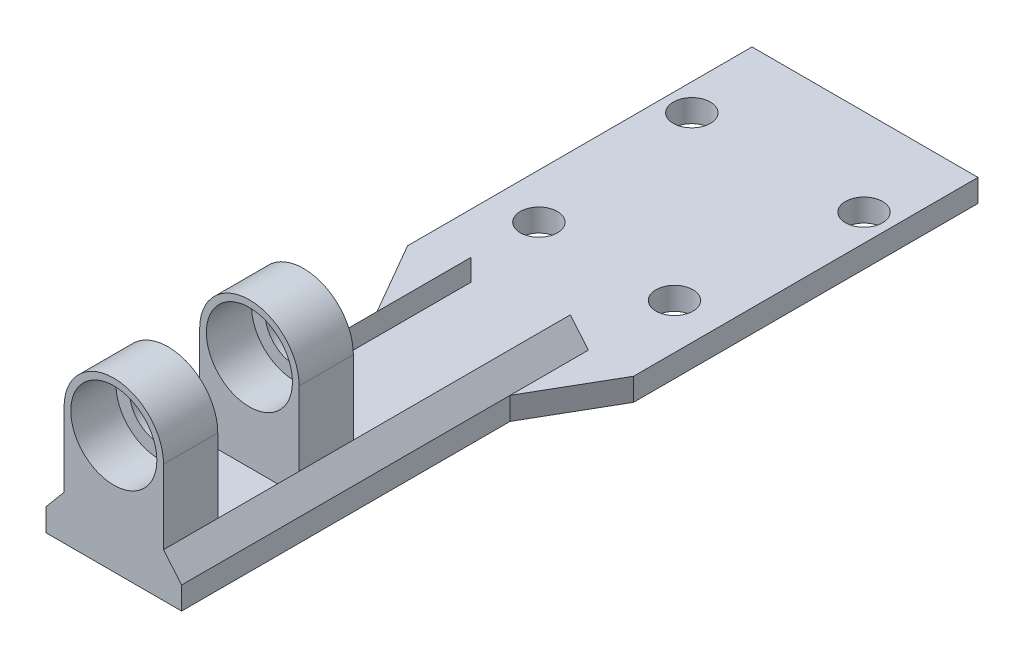
from build123d import *

# Parameters (mm, degrees)
BOSS_EXTRU_7_DEPTH         = 5
BOSS_EXTRU_8_DEPTH         = 12
ESQUISSE25_R               = 9.525
ENL_V_MAT_EXTRU_1_DEPTH    = 10
R_P_TITION_LIN_AIRE2_COUNT = 2
R_P_TITION_LIN_AIRE2_PITCH = 30
ESQUISSE22_R               = 4.1
BOSS_EXTRU_9_DEPTH         = 5
ESQUISSE26_R               = 6.5
ENL_V_MAT_EXTRU_2_DEPTH    = 163.491730559
BOSS_EXTRU_10_START        = -90
BOSS_EXTRU_10_DEPTH        = 78


with BuildPart() as part:
    # Esquisse20 → Boss.-Extru.7 (new body)
    with BuildSketch(Plane.XZ):
        Polygon((-25, 0), (-15, 17.320508076), (-15, 90), (15, 90), (15, 17.320508076), (25, 0), align=None)
    extrude(amount=-BOSS_EXTRU_7_DEPTH)

    # Esquisse21 → Boss.-Extru.8 (add)
    with BuildSketch(Plane.XY.offset(90)):
        with BuildLine():
            Line((-15, 5), (-11, 9.76701437))
            Line((-11, 9.76701437), (-11, 26.15))
            ThreePointArc((-11, 26.15), (0, 37.15), (11, 26.15))
            Line((11, 26.15), (11, 9.76701437))
            Line((11, 9.76701437), (15, 5))
            Line((15, 5), (-15, 5))
        make_face()
    boss_extru_8 = extrude(amount=-BOSS_EXTRU_8_DEPTH)

    # Esquisse25 → Enlèv. mat.-Extru.1 (cut)
    with BuildSketch(Plane.XY.offset(90)):
        with Locations((0, 26.15)):
            Circle(ESQUISSE25_R)
    enl_v_mat_extru_1 = extrude(amount=-ENL_V_MAT_EXTRU_1_DEPTH, mode=Mode.SUBTRACT)

    # Répétition linéaire2: Boss.-Extru.8, Enlèv. mat.-Extru.1 ×2
    with Locations(*[(0, 0, -i * R_P_TITION_LIN_AIRE2_PITCH) for i in range(1, R_P_TITION_LIN_AIRE2_COUNT)]):
        add(boss_extru_8)
        add(enl_v_mat_extru_1, mode=Mode.SUBTRACT)

    # Esquisse22 → Boss.-Extru.9 (add)
    with BuildSketch(Plane(origin=(0, 5, 0), x_dir=(1, 0, 0), z_dir=(0, 1, 0))):
        Polygon((-25, 0), (25, 0), (25, 38.1), (25, 76.2), (-25, 76.2), (-25, 38.1), align=None)
        with Locations(Location((-15, 19.05, 0), (0, 0, 270))):
            Circle(ESQUISSE22_R, mode=Mode.SUBTRACT)
        with Locations(Location((15, 19.05, 0), (0, 0, 270))):
            Circle(ESQUISSE22_R, mode=Mode.SUBTRACT)
        with Locations(Location((19.05, 56.934132562, 0), (0, 0, 270))):
            Circle(ESQUISSE22_R, mode=Mode.SUBTRACT)
        with Locations(Location((-19.05, 56.934132562, 0), (0, 0, 270))):
            Circle(ESQUISSE22_R, mode=Mode.SUBTRACT)
    extrude(amount=-BOSS_EXTRU_9_DEPTH)

    # Esquisse26 → Enlèv. mat.-Extru.2 (cut, through all)
    with BuildSketch(Plane.XY.offset(80)):
        with Locations((0, 26.15)):
            Circle(ESQUISSE26_R)
    extrude(amount=-ENL_V_MAT_EXTRU_2_DEPTH, mode=Mode.SUBTRACT)

    # Esquisse27 → Boss.-Extru.10 (add)
    with BuildSketch(Plane.XY.offset(90).offset(BOSS_EXTRU_10_START)):
        Polygon((-11, 9.76701437), (-11, 5), (-15, 5), align=None)
        Polygon((15, 5), (11, 9.76701437), (11, 5), align=None)
    extrude(amount=BOSS_EXTRU_10_DEPTH)


solid = part.part
